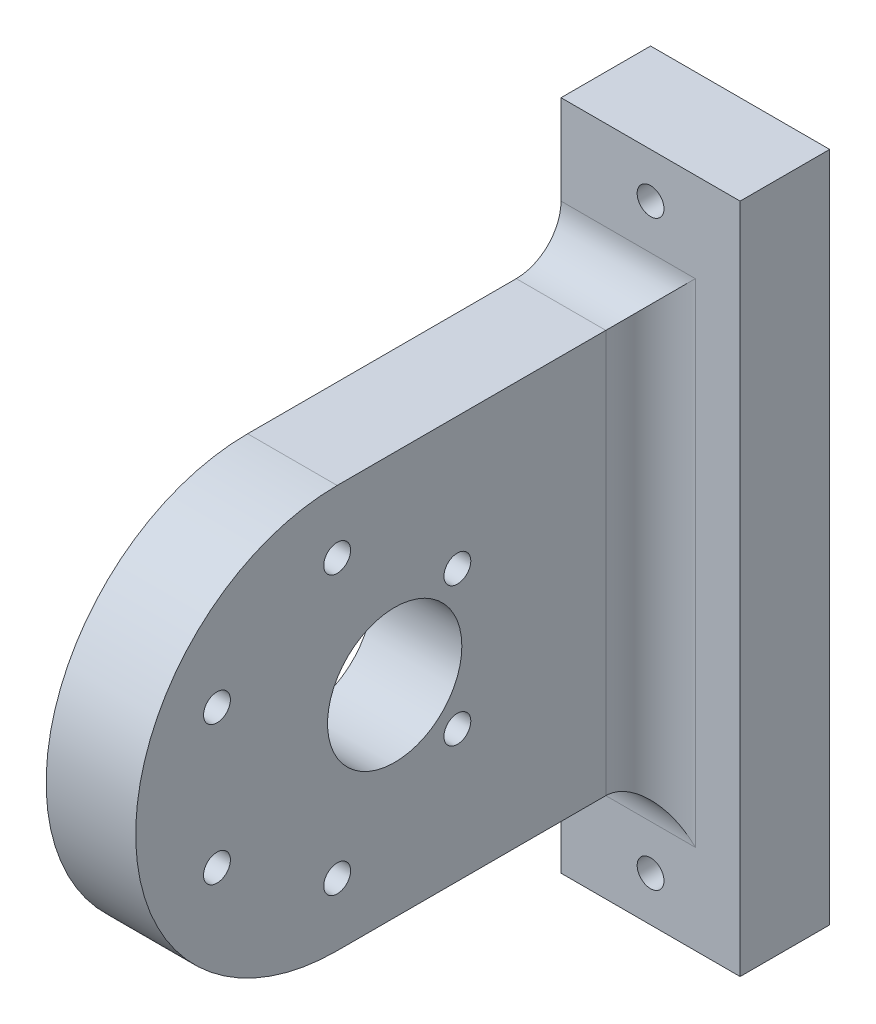
from build123d import *

# Parameters (mm, degrees)
SKETCH1_R           = 7.5
SKETCH1_R_2         = 1.5
BOSS_EXTRUDE1_DEPTH = 10
FILLET1_R           = 5
FILLET2_R           = 5
SKETCH2_W           = 10
SKETCH2_H           = 75
BOSS_EXTRUDE2_DEPTH = 10
FILLET3_R           = 5
SKETCH3_R           = 1.5
CUT_EXTRUDE1_DEPTH  = 10


with BuildPart() as part:
    # Sketch1 → Boss-Extrude1 (new body)
    with BuildSketch(Plane(origin=(0, 0, 0), x_dir=(0, 0, -1), z_dir=(1, 0, 0))):
        with BuildLine():
            Line((0, 0), (35, 0))
            Line((35, 0), (35, -15))
            Line((35, -15), (45, -15))
            Line((45, -15), (45, 60))
            Line((45, 60), (35, 60))
            Line((35, 60), (35, 45))
            Line((35, 45), (0, 45))
            ThreePointArc((0, 45), (-22.5, 22.5), (0, 0))
        make_face()
        with Locations((6.423393759, 22.5)):
            Circle(SKETCH1_R, mode=Mode.SUBTRACT)
        with Locations((13.423393759, 30.25)):
            Circle(SKETCH1_R_2, mode=Mode.SUBTRACT)
        with Locations((0, 38)):
            Circle(SKETCH1_R_2, mode=Mode.SUBTRACT)
        with Locations((-13.423393759, 30.25)):
            Circle(SKETCH1_R_2, mode=Mode.SUBTRACT)
        with Locations((-13.423393759, 14.75)):
            Circle(SKETCH1_R_2, mode=Mode.SUBTRACT)
        with Locations((0, 7)):
            Circle(SKETCH1_R_2, mode=Mode.SUBTRACT)
        with Locations((13.423393759, 14.75)):
            Circle(SKETCH1_R_2, mode=Mode.SUBTRACT)
    extrude(amount=BOSS_EXTRUDE1_DEPTH)

    # Fillet1
    fillet1_edges = [part.edges().sort_by_distance(p)[0] for p in [
        (5, 45, -35),
    ]]
    fillet(fillet1_edges, radius=FILLET1_R)

    # Fillet2
    fillet2_edges = [part.edges().sort_by_distance(p)[0] for p in [
        (5, 0, -35),
    ]]
    fillet(fillet2_edges, radius=FILLET2_R)

    # Sketch2 → Boss-Extrude2 (add)
    with BuildSketch(Plane(origin=(10, 0, 0), x_dir=(0, 0, -1), z_dir=(1, 0, 0))):
        with Locations((40, 22.5)):
            Rectangle(SKETCH2_W, SKETCH2_H)
    extrude(amount=BOSS_EXTRUDE2_DEPTH)

    # Fillet3
    fillet3_edges = [part.edges().sort_by_distance(p)[0] for p in [
        (10, 22.5, -35),
    ]]
    fillet(fillet3_edges, radius=FILLET3_R)

    # Sketch3 → Cut-Extrude1 (cut)
    with BuildSketch(Plane.XY.offset(-35)):
        with Locations((10, -10)):
            Circle(SKETCH3_R)
        with Locations((10, 55)):
            Circle(SKETCH3_R)
    extrude(amount=-CUT_EXTRUDE1_DEPTH, mode=Mode.SUBTRACT)


solid = part.part
